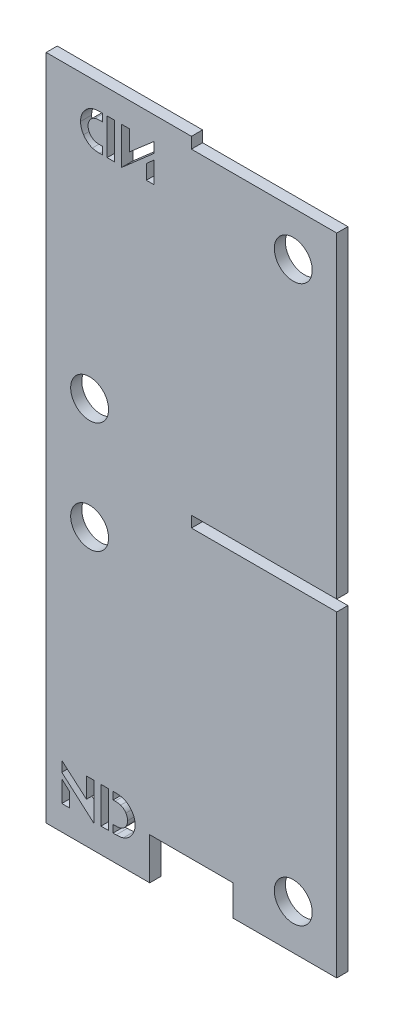
from build123d import *

# Parameters (mm, degrees)
SKETCH1_W           = 132.715
SKETCH1_H           = 304.8
BOSS_EXTRUDE1_DEPTH = 5.08
CUT_EXTRUDE1_REACH  = 168.298
SKETCH3_W           = 38.1
SKETCH3_H           = 38.1
SKETCH3_W_2         = 47.3075
SKETCH3_H_2         = 5.08
SKETCH3_W_3         = 66.3575
SKETCH3_W_4         = 76.2
CUT_EXTRUDE2_REACH  = 168.298
SKETCH4_R           = 8.661049874
CUT_EXTRUDE3_REACH  = 168.298
SKETCH5_W           = 3.439712524
SKETCH5_H           = 16.510620117
CUT_EXTRUDE4_REACH  = 168.298
SKETCH6_W           = 3.439712525
SKETCH6_H           = 16.510620117


with BuildPart() as part:
    # Sketch1 → Boss-Extrude1 (new body)
    with BuildSketch(Plane.XY):
        Rectangle(SKETCH1_W, SKETCH1_H)
    extrude(amount=BOSS_EXTRUDE1_DEPTH)

    # Sketch3 → Cut-Extrude1 (cut, up to next)
    with BuildSketch(Plane.XY, mode=Mode.PRIVATE) as cut_extrude1_sk1:
        with Locations((0, -152.4)):
            Rectangle(SKETCH3_W, SKETCH3_H)
    cut_extrude1_tool1 = extrude(cut_extrude1_sk1.sketch, amount=CUT_EXTRUDE1_REACH, mode=Mode.PRIVATE) & part.part
    # Sketch3 → Cut-Extrude1 (cut, up to next)
    with BuildSketch(Plane.XY, mode=Mode.PRIVATE) as cut_extrude1_sk2:
        with Locations((42.70375, -149.86)):
            Rectangle(SKETCH3_W_2, SKETCH3_H_2)
    cut_extrude1_tool2 = extrude(cut_extrude1_sk2.sketch, amount=CUT_EXTRUDE1_REACH, mode=Mode.PRIVATE) & part.part
    # Sketch3 → Cut-Extrude1 (cut, up to next)
    with BuildSketch(Plane.XY, mode=Mode.PRIVATE) as cut_extrude1_sk3:
        with Locations((33.17875, 0)):
            Rectangle(SKETCH3_W_3, SKETCH3_H_2)
    cut_extrude1_tool3 = extrude(cut_extrude1_sk3.sketch, amount=CUT_EXTRUDE1_REACH, mode=Mode.PRIVATE) & part.part
    # Sketch3 → Cut-Extrude1 (cut, up to next)
    with BuildSketch(Plane.XY, mode=Mode.PRIVATE) as cut_extrude1_sk4:
        with Locations((38.1, 149.86)):
            Rectangle(SKETCH3_W_4, SKETCH3_H_2)
    cut_extrude1_tool4 = extrude(cut_extrude1_sk4.sketch, amount=CUT_EXTRUDE1_REACH, mode=Mode.PRIVATE) & part.part
    add(cut_extrude1_tool1.solids().sort_by_distance((0, -152.4, 0))[0], mode=Mode.SUBTRACT)
    add(cut_extrude1_tool2.solids().sort_by_distance((42.70375, -149.86, 0))[0], mode=Mode.SUBTRACT)
    add(cut_extrude1_tool3.solids().sort_by_distance((33.17875, 0, 0))[0], mode=Mode.SUBTRACT)
    add(cut_extrude1_tool4.solids().sort_by_distance((38.1, 149.86, 0))[0], mode=Mode.SUBTRACT)

    # Sketch4 → Cut-Extrude2 (cut, up to next)
    with BuildSketch(Plane.XY.offset(5.08), mode=Mode.PRIVATE) as cut_extrude2_sk1:
        with Locations((-46.502678155, 25.4)):
            Circle(SKETCH4_R)
    cut_extrude2_tool1 = extrude(cut_extrude2_sk1.sketch, amount=-CUT_EXTRUDE2_REACH, mode=Mode.PRIVATE) & part.part
    # Sketch4 → Cut-Extrude2 (cut, up to next)
    with BuildSketch(Plane.XY.offset(5.08), mode=Mode.PRIVATE) as cut_extrude2_sk2:
        with Locations((-46.502678155, -25.4)):
            Circle(SKETCH4_R)
    cut_extrude2_tool2 = extrude(cut_extrude2_sk2.sketch, amount=-CUT_EXTRUDE2_REACH, mode=Mode.PRIVATE) & part.part
    # Sketch4 → Cut-Extrude2 (cut, up to next)
    with BuildSketch(Plane.XY.offset(5.08), mode=Mode.PRIVATE) as cut_extrude2_sk3:
        with Locations((46.502678155, -127)):
            Circle(SKETCH4_R)
    cut_extrude2_tool3 = extrude(cut_extrude2_sk3.sketch, amount=-CUT_EXTRUDE2_REACH, mode=Mode.PRIVATE) & part.part
    # Sketch4 → Cut-Extrude2 (cut, up to next)
    with BuildSketch(Plane.XY.offset(5.08), mode=Mode.PRIVATE) as cut_extrude2_sk4:
        with Locations((46.502678155, 127)):
            Circle(SKETCH4_R)
    cut_extrude2_tool4 = extrude(cut_extrude2_sk4.sketch, amount=-CUT_EXTRUDE2_REACH, mode=Mode.PRIVATE) & part.part
    add(cut_extrude2_tool1.solids().sort_by_distance((-46.502678, 25.4, 5.08))[0], mode=Mode.SUBTRACT)
    add(cut_extrude2_tool2.solids().sort_by_distance((-46.502678, -25.4, 5.08))[0], mode=Mode.SUBTRACT)
    add(cut_extrude2_tool3.solids().sort_by_distance((46.502678, -127, 5.08))[0], mode=Mode.SUBTRACT)
    add(cut_extrude2_tool4.solids().sort_by_distance((46.502678, 127, 5.08))[0], mode=Mode.SUBTRACT)

    # Sketch5 → Cut-Extrude3 (cut, up to next)
    with BuildSketch(Plane(origin=(0, 0, 0), x_dir=(-1, 0, 0), z_dir=(0, 0, -1)), mode=Mode.PRIVATE) as cut_extrude3_sk1:
        Polygon((17.163207331, 124.711073403), (17.163207331, 134.431844318), (20.602919855, 131.321770911), (20.602919855, 124.711073403), align=None)
    cut_extrude3_tool1 = extrude(cut_extrude3_sk1.sketch, amount=-CUT_EXTRUDE3_REACH, mode=Mode.PRIVATE) & part.part
    # Sketch5 → Cut-Extrude3 (cut, up to next)
    with BuildSketch(Plane(origin=(0, 0, 0), x_dir=(-1, 0, 0), z_dir=(0, 0, -1)), mode=Mode.PRIVATE) as cut_extrude3_sk2:
        Polygon((17.163207331, 137.04745905), (17.163207331, 141.755565568), (28.399601577, 132.006130382), (28.399601577, 141.22169352), (31.839314102, 141.22169352), (31.839314102, 124.180784389), align=None)
    cut_extrude3_tool2 = extrude(cut_extrude3_sk2.sketch, amount=-CUT_EXTRUDE3_REACH, mode=Mode.PRIVATE) & part.part
    # Sketch5 → Cut-Extrude3 (cut, up to next)
    with BuildSketch(Plane(origin=(0, 0, 0), x_dir=(-1, 0, 0), z_dir=(0, 0, -1)), mode=Mode.PRIVATE) as cut_extrude3_sk3:
        with Locations((36.76956872, 132.966383462)):
            Rectangle(SKETCH5_W, SKETCH5_H)
    cut_extrude3_tool3 = extrude(cut_extrude3_sk3.sketch, amount=-CUT_EXTRUDE3_REACH, mode=Mode.PRIVATE) & part.part
    # Sketch5 → Cut-Extrude3 (cut, up to next)
    with BuildSketch(Plane(origin=(0, 0, 0), x_dir=(-1, 0, 0), z_dir=(0, 0, -1)), mode=Mode.PRIVATE) as cut_extrude3_sk4:
        with BuildLine():
            Line((40.553252497, 124.711073403), (40.553252497, 128.150785927))
            Line((40.553252497, 128.150785927), (41.846727728, 128.150785927))
            add(Edge.make_bspline(
                [(41.846727728, 128.150785927), (42.300616171, 128.149876899), (43.110183241, 128.192380536), (43.90540936, 128.359363446), (44.236611325, 128.491174146)],
                knots=[0, 0, 0, 0, 0.56116253, 1, 1, 1, 1], degree=3))
            add(Edge.make_bspline(
                [(44.236611325, 128.491174146), (44.472536529, 128.589488875), (44.820898064, 128.752822089), (45.242991159, 129.040463193), (45.545764218, 129.274910538), (45.826134274, 129.542829022), (46.179858125, 129.942268948), (46.415424995, 130.27281381), (46.554834245, 130.50842222)],
                knots=[0, 0, 0, 0, 0.245408386, 0.36669755, 0.488992835, 0.612078576, 0.737761538, 1, 1, 1, 1], degree=3))
            add(Edge.make_bspline(
                [(46.554834245, 130.50842222), (46.765648404, 130.870963881), (47.101073962, 131.654041924), (47.205009522, 132.499834811), (47.203363378, 132.923387055)],
                knots=[0, 0, 0, 0, 0.497557298, 1, 1, 1, 1], degree=3))
            add(Edge.make_bspline(
                [(47.203363378, 132.923387055), (47.209030172, 133.393250973), (47.075947954, 134.325978685), (46.686142569, 135.183408289), (46.433011093, 135.571249092)],
                knots=[0, 0, 0, 0, 0.503603605, 1, 1, 1, 1], degree=3))
            add(Edge.make_bspline(
                [(46.433011093, 135.571249092), (46.288488032, 135.797988893), (46.045674356, 136.114829291), (45.681252361, 136.495604224), (45.391038936, 136.751330992), (45.077294344, 136.976237027), (44.635748988, 137.247221319), (44.277031791, 137.40274574), (44.032378394, 137.491755251)],
                knots=[0, 0, 0, 0, 0.257366124, 0.381148216, 0.504363433, 0.627238334, 0.75044293, 1, 1, 1, 1], degree=3))
            add(Edge.make_bspline(
                [(44.032378394, 137.491755251), (43.876879098, 137.545524244), (43.623826472, 137.607946521), (43.266374994, 137.669720685), (42.958366313, 137.714275489), (42.623512072, 137.745292538), (42.12062539, 137.773436985), (41.729826002, 137.784450875), (41.459760069, 137.781980995)],
                knots=[0, 0, 0, 0, 0.189708041, 0.300315324, 0.418659325, 0.548841448, 0.68832671, 1, 1, 1, 1], degree=3))
            Line((41.459760069, 137.781980995), (40.553252497, 137.781980995))
            Line((40.553252497, 137.781980995), (40.553252497, 141.22169352))
            Line((40.553252497, 141.22169352), (41.82164649, 141.22169352))
            add(Edge.make_bspline(
                [(41.82164649, 141.22169352), (42.450048307, 141.219004232), (43.622542511, 141.15808905), (44.768828289, 140.898986965), (45.279274184, 140.716485743)],
                knots=[0, 0, 0, 0, 0.537427262, 1, 1, 1, 1], degree=3))
            add(Edge.make_bspline(
                [(45.279274184, 140.716485743), (45.664145573, 140.583073085), (46.224630407, 140.332335999), (46.92106189, 139.905547669), (47.42307731, 139.545557341), (47.900455129, 139.139786442), (48.510354829, 138.527671245), (48.91898734, 138.013805054), (49.174032011, 137.652991776)],
                knots=[0, 0, 0, 0, 0.242521731, 0.364141481, 0.485935816, 0.610069142, 0.736811926, 1, 1, 1, 1], degree=3))
            add(Edge.make_bspline(
                [(49.174032011, 137.652991776), (49.414517751, 137.30906966), (49.735138587, 136.768540186), (50.075797232, 136.009973478), (50.286481561, 135.431151021), (50.442531037, 134.836802263), (50.597246405, 134.020679213), (50.647008327, 133.394516748), (50.643075902, 132.973549529)],
                knots=[0, 0, 0, 0, 0.252619336, 0.377177125, 0.500231396, 0.623024868, 0.746707826, 1, 1, 1, 1], degree=3))
            add(Edge.make_bspline(
                [(50.643075902, 132.973549529), (50.645083972, 132.564597419), (50.597412932, 131.955591906), (50.462936441, 131.15741629), (50.308062828, 130.578133429), (50.120283678, 130.008825301), (49.800259634, 129.266039689), (49.506529986, 128.731230173), (49.281523028, 128.390849197)],
                knots=[0, 0, 0, 0, 0.252737157, 0.377246632, 0.500185282, 0.623319164, 0.747793558, 1, 1, 1, 1], degree=3))
            add(Edge.make_bspline(
                [(49.281523028, 128.390849197), (49.030453132, 128.004846678), (48.616017215, 127.460659742), (47.989680793, 126.814176664), (47.498498398, 126.382146552), (46.977449847, 126.001830518), (46.244152842, 125.557121569), (45.652610907, 125.300734367), (45.247026879, 125.158952638)],
                knots=[0, 0, 0, 0, 0.26224098, 0.388281235, 0.512171894, 0.634355035, 0.755218741, 1, 1, 1, 1], degree=3))
            add(Edge.make_bspline(
                [(45.247026879, 125.158952638), (44.763060606, 124.995649101), (43.675081161, 124.766870335), (42.565667684, 124.713531287), (41.968550879, 124.711073403)],
                knots=[0, 0, 0, 0, 0.460500658, 1, 1, 1, 1], degree=3))
            Line((41.968550879, 124.711073403), (40.553252497, 124.711073403))
        make_face()
    cut_extrude3_tool4 = extrude(cut_extrude3_sk4.sketch, amount=-CUT_EXTRUDE3_REACH, mode=Mode.PRIVATE) & part.part
    add(cut_extrude3_tool1.solids().sort_by_distance((-18.77389, 128.843296, 0))[0], mode=Mode.SUBTRACT)
    add(cut_extrude3_tool2.solids().sort_by_distance((-17.392175, 139.401512, 0))[0], mode=Mode.SUBTRACT)
    add(cut_extrude3_tool3.solids().sort_by_distance((-36.769569, 132.966383, 0))[0], mode=Mode.SUBTRACT)
    add(cut_extrude3_tool4.solids().sort_by_distance((-40.74675, 126.43093, 0))[0], mode=Mode.SUBTRACT)

    # Sketch6 → Cut-Extrude4 (cut, up to next)
    with BuildSketch(Plane.XY.offset(5.08), mode=Mode.PRIVATE) as cut_extrude4_sk1:
        Polygon((-59.196803823, -141.077730285), (-59.196803823, -131.35695937), (-55.757091298, -134.467032777), (-55.757091298, -141.077730285), align=None)
    cut_extrude4_tool1 = extrude(cut_extrude4_sk1.sketch, amount=-CUT_EXTRUDE4_REACH, mode=Mode.PRIVATE) & part.part
    # Sketch6 → Cut-Extrude4 (cut, up to next)
    with BuildSketch(Plane.XY.offset(5.08), mode=Mode.PRIVATE) as cut_extrude4_sk2:
        Polygon((-59.196803823, -128.741344638), (-59.196803823, -124.03323812), (-47.960409576, -133.782673306), (-47.960409576, -124.567110168), (-44.520697052, -124.567110168), (-44.520697052, -141.608019299), align=None)
    cut_extrude4_tool2 = extrude(cut_extrude4_sk2.sketch, amount=-CUT_EXTRUDE4_REACH, mode=Mode.PRIVATE) & part.part
    # Sketch6 → Cut-Extrude4 (cut, up to next)
    with BuildSketch(Plane.XY.offset(5.08), mode=Mode.PRIVATE) as cut_extrude4_sk3:
        with Locations((-39.590442434, -132.822420227)):
            Rectangle(SKETCH6_W, SKETCH6_H)
    cut_extrude4_tool3 = extrude(cut_extrude4_sk3.sketch, amount=-CUT_EXTRUDE4_REACH, mode=Mode.PRIVATE) & part.part
    # Sketch6 → Cut-Extrude4 (cut, up to next)
    with BuildSketch(Plane.XY.offset(5.08), mode=Mode.PRIVATE) as cut_extrude4_sk4:
        with BuildLine():
            Line((-35.806758657, -141.077730285), (-35.806758657, -137.638017761))
            Line((-35.806758657, -137.638017761), (-34.513283426, -137.638017761))
            add(Edge.make_bspline(
                [(-34.513283426, -137.638017761), (-34.059394982, -137.638926789), (-33.249827913, -137.596423152), (-32.454601793, -137.429440242), (-32.123399828, -137.297629542)],
                knots=[0, 0, 0, 0, 0.56116253, 1, 1, 1, 1], degree=3))
            add(Edge.make_bspline(
                [(-32.123399828, -137.297629542), (-31.887474625, -137.199314813), (-31.539113089, -137.035981599), (-31.117019995, -136.748340494), (-30.814246936, -136.51389315), (-30.533876879, -136.245974666), (-30.180153028, -135.84653474), (-29.944586158, -135.515989878), (-29.805176908, -135.280381468)],
                knots=[0, 0, 0, 0, 0.245408386, 0.36669755, 0.488992835, 0.612078576, 0.737761538, 1, 1, 1, 1], degree=3))
            add(Edge.make_bspline(
                [(-29.805176908, -135.280381468), (-29.59436275, -134.917839807), (-29.258937191, -134.134761764), (-29.155001631, -133.288968877), (-29.156647776, -132.865416633)],
                knots=[0, 0, 0, 0, 0.497557298, 1, 1, 1, 1], degree=3))
            add(Edge.make_bspline(
                [(-29.156647776, -132.865416633), (-29.150980982, -132.395552715), (-29.284063199, -131.462825002), (-29.673868585, -130.605395399), (-29.92700006, -130.217554596)],
                knots=[0, 0, 0, 0, 0.503603605, 1, 1, 1, 1], degree=3))
            add(Edge.make_bspline(
                [(-29.92700006, -130.217554596), (-30.071523122, -129.990814795), (-30.314336798, -129.673974397), (-30.678758792, -129.293199464), (-30.968972217, -129.037472696), (-31.28271681, -128.812566661), (-31.724262165, -128.541582369), (-32.082979363, -128.386057948), (-32.327632759, -128.297048437)],
                knots=[0, 0, 0, 0, 0.257366124, 0.381148216, 0.504363433, 0.627238334, 0.75044293, 1, 1, 1, 1], degree=3))
            add(Edge.make_bspline(
                [(-32.327632759, -128.297048437), (-32.483132055, -128.243279443), (-32.736184681, -128.180857166), (-33.093636159, -128.119083003), (-33.401644841, -128.074528199), (-33.736499082, -128.04351115), (-34.239385763, -128.015366703), (-34.630185152, -128.004352813), (-34.900251085, -128.006822692)],
                knots=[0, 0, 0, 0, 0.189708041, 0.300315324, 0.418659325, 0.548841448, 0.68832671, 1, 1, 1, 1], degree=3))
            Line((-34.900251085, -128.006822692), (-35.806758657, -128.006822692))
            Line((-35.806758657, -128.006822692), (-35.806758657, -124.567110168))
            Line((-35.806758657, -124.567110168), (-34.538364663, -124.567110168))
            add(Edge.make_bspline(
                [(-34.538364663, -124.567110168), (-33.909962847, -124.569799456), (-32.737468643, -124.630714638), (-31.591182865, -124.889816723), (-31.080736969, -125.072317945)],
                knots=[0, 0, 0, 0, 0.537427262, 1, 1, 1, 1], degree=3))
            add(Edge.make_bspline(
                [(-31.080736969, -125.072317945), (-30.695865581, -125.205730603), (-30.135380747, -125.456467688), (-29.438949264, -125.883256019), (-28.936933844, -126.243246347), (-28.459556025, -126.649017246), (-27.849656325, -127.261132443), (-27.441023814, -127.774998634), (-27.185979142, -128.135811912)],
                knots=[0, 0, 0, 0, 0.242521731, 0.364141481, 0.485935816, 0.610069142, 0.736811926, 1, 1, 1, 1], degree=3))
            add(Edge.make_bspline(
                [(-27.185979142, -128.135811912), (-26.945493402, -128.479734027), (-26.624872566, -129.020263501), (-26.284213921, -129.77883021), (-26.073529592, -130.357652666), (-25.917480116, -130.952001425), (-25.762764748, -131.768124475), (-25.713002827, -132.39428694), (-25.716935252, -132.815254159)],
                knots=[0, 0, 0, 0, 0.252619336, 0.377177125, 0.500231396, 0.623024868, 0.746707826, 1, 1, 1, 1], degree=3))
            add(Edge.make_bspline(
                [(-25.716935252, -132.815254159), (-25.714927182, -133.224206268), (-25.762598222, -133.833211782), (-25.897074713, -134.631387398), (-26.051948325, -135.210670259), (-26.239727475, -135.779978387), (-26.559751519, -136.522763999), (-26.853481167, -137.057573515), (-27.078488126, -137.397954491)],
                knots=[0, 0, 0, 0, 0.252737157, 0.377246632, 0.500185282, 0.623319164, 0.747793558, 1, 1, 1, 1], degree=3))
            add(Edge.make_bspline(
                [(-27.078488126, -137.397954491), (-27.329558022, -137.78395701), (-27.743993939, -138.328143946), (-28.37033036, -138.974627023), (-28.861512755, -139.406657136), (-29.382561306, -139.78697317), (-30.115858311, -140.231682118), (-30.707400247, -140.488069321), (-31.112984274, -140.62985105)],
                knots=[0, 0, 0, 0, 0.26224098, 0.388281235, 0.512171894, 0.634355035, 0.755218741, 1, 1, 1, 1], degree=3))
            add(Edge.make_bspline(
                [(-31.112984274, -140.62985105), (-31.596950547, -140.793154587), (-32.684929992, -141.021933353), (-33.794343469, -141.075272401), (-34.391460274, -141.077730285)],
                knots=[0, 0, 0, 0, 0.460500658, 1, 1, 1, 1], degree=3))
            Line((-34.391460274, -141.077730285), (-35.806758657, -141.077730285))
        make_face()
    cut_extrude4_tool4 = extrude(cut_extrude4_sk4.sketch, amount=-CUT_EXTRUDE4_REACH, mode=Mode.PRIVATE) & part.part
    add(cut_extrude4_tool1.solids().sort_by_distance((-57.586121, -136.945508, 5.08))[0], mode=Mode.SUBTRACT)
    add(cut_extrude4_tool2.solids().sort_by_distance((-58.967836, -126.387291, 5.08))[0], mode=Mode.SUBTRACT)
    add(cut_extrude4_tool3.solids().sort_by_distance((-39.590442, -132.82242, 5.08))[0], mode=Mode.SUBTRACT)
    add(cut_extrude4_tool4.solids().sort_by_distance((-35.613262, -139.357874, 5.08))[0], mode=Mode.SUBTRACT)


solid = part.part
